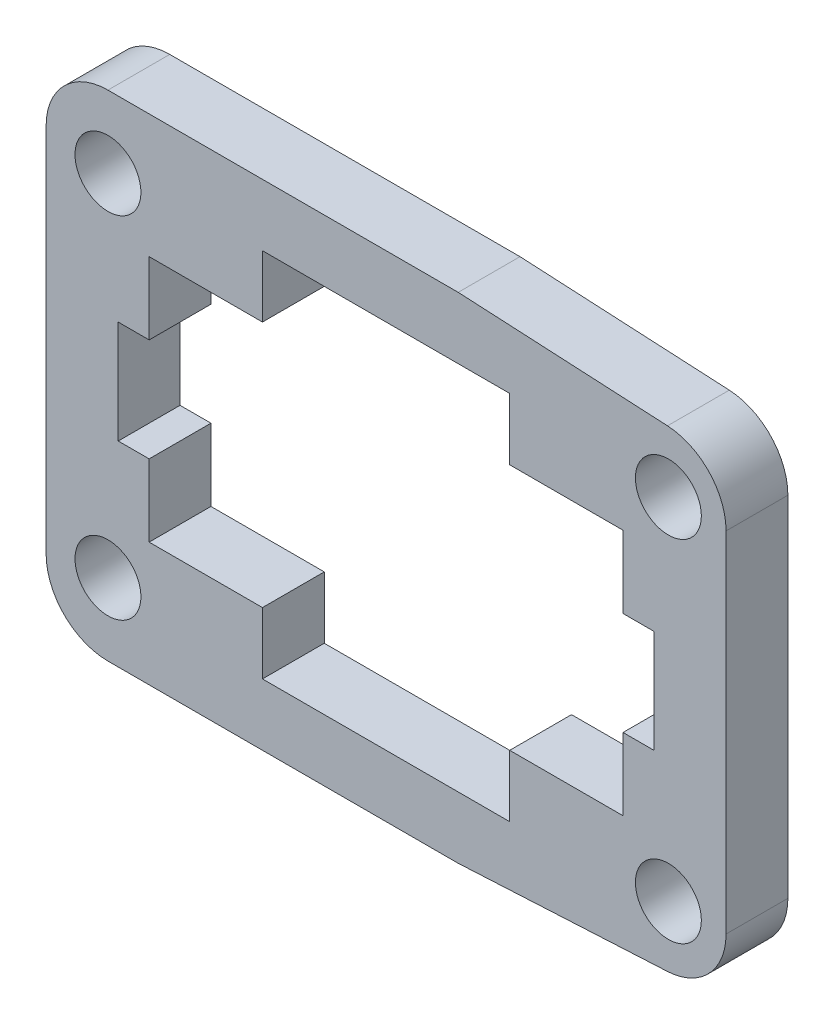
from build123d import *

# Parameters (mm, degrees)
SKETCH_1_R          = 1.35
SKETCH_1_R_2        = 1
EXTRUDE_1_DEPTH     = 3
SKETCH_2_R          = 1.6
CUT_EXTRUDE_1_DEPTH = 37.133094234


with BuildPart() as part:
    # 草图1 → 凸台-拉伸1 (new body)
    with BuildSketch(Plane.XY.offset(3)):
        with BuildLine():
            Line((13.843681844, 23.9998), (-3.157118156, 23.9998))
            ThreePointArc((-3.157118156, 23.9998), (-5.2784385, 23.121120344), (-6.157118156, 20.9998))
            Line((-6.157118156, 20.9998), (-6.157118156, 3))
            ThreePointArc((-6.157118156, 3), (-5.2784385, 0.878679656), (-3.157118156, 0))
            Line((-3.157118156, 0), (13.843681844, 0))
            Line((13.843681844, 0), (24.001386189, 0.533010723))
            ThreePointArc((24.001386189, 0.533010723), (26.020372671, 1.463896655), (26.844181844, 3.528889024))
            Line((26.844181844, 3.528889024), (26.844181844, 20.471910982))
            ThreePointArc((26.844181844, 20.471910982), (26.020271299, 22.537010177), (24.001092054, 23.467804703))
            Line((24.001092054, 23.467804703), (13.843681844, 23.9998))
        make_face()
        with Locations(Location((24.044031844, 3.501148349, 0), (0, 0, 180))):
            Circle(SKETCH_1_R, mode=Mode.SUBTRACT)
        with Locations(Location((-3.156018156, 3.501148349, 0), (0, 0, 180))):
            Circle(SKETCH_1_R, mode=Mode.SUBTRACT)
        with Locations(Location((24.044031844, 20.498351651, 0), (0, 0, 180))):
            Circle(SKETCH_1_R, mode=Mode.SUBTRACT)
        with Locations(Location((-3.156018156, 20.498351651, 0), (0, 0, 180))):
            Circle(SKETCH_1_R_2, mode=Mode.SUBTRACT)
        Polygon((21.843181844, 14.4995), (23.343481844, 14.4995), (23.343481844, 9.5), (21.843181844, 9.5), (21.843181844, 6), (16.343381844, 6), (16.343381844, 3), (4.343381844, 3), (4.343381844, 6), (-1.156518156, 6), (-1.156518156, 9.5), (-2.656818156, 9.5), (-2.656818156, 14.4995), (-1.156518156, 14.4995), (-1.156518156, 17.9998), (4.343381844, 17.9998), (4.343381844, 20.9998), (16.343381844, 20.9998), (16.343381844, 17.9998), (21.843181844, 17.9998), align=None, mode=Mode.SUBTRACT)
    extrude(amount=-EXTRUDE_1_DEPTH)

    # 草图2 → 切除-拉伸1 (cut, through all)
    with BuildSketch(Plane.XY.offset(3)):
        with Locations((-3.156018156, 20.498351651)):
            Circle(SKETCH_2_R)
        with Locations((24.044031844, 20.498351651)):
            Circle(SKETCH_2_R)
        with Locations((24.044031844, 3.501148349)):
            Circle(SKETCH_2_R)
        with Locations((-3.156018156, 3.501148349)):
            Circle(SKETCH_2_R)
    extrude(amount=-CUT_EXTRUDE_1_DEPTH, mode=Mode.SUBTRACT)


solid = part.part
